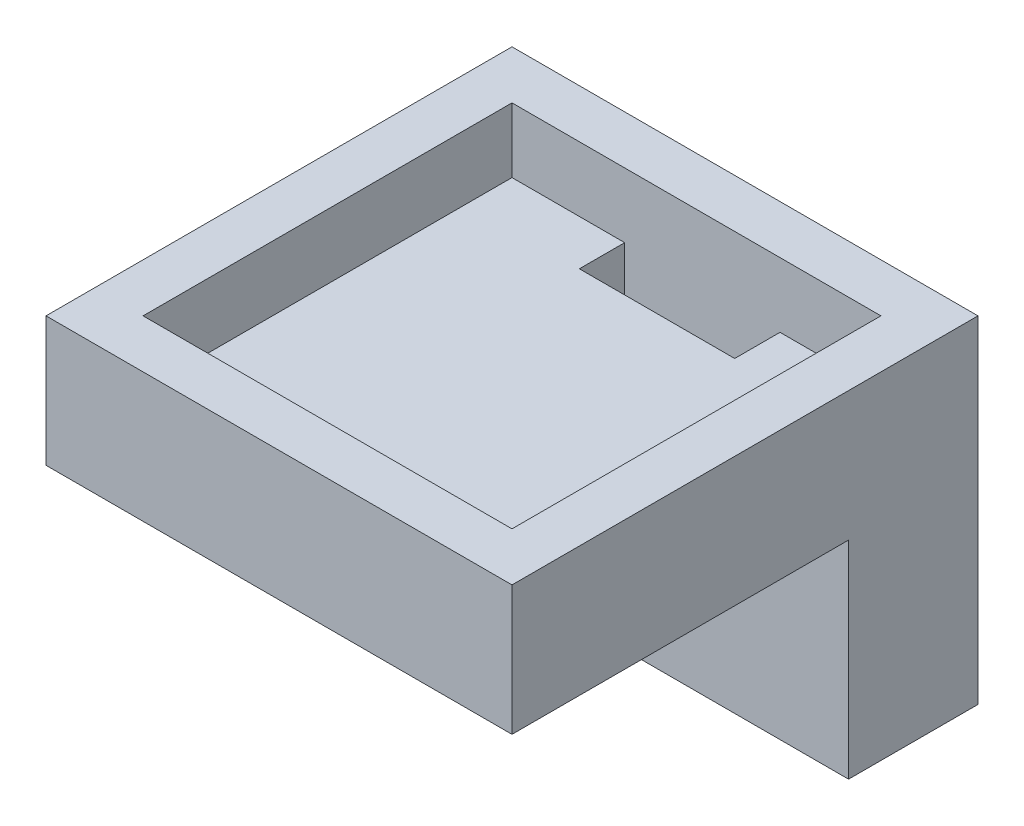
from build123d import *

# Parameters (mm, degrees)
SKETCH_1_W      = 36
SKETCH_1_H      = 36
SKETCH_1_W_2    = 12
SKETCH_1_H_2    = 3.5
EXTRUDE_1_DEPTH = 5
SKETCH_2_W      = 36
SKETCH_2_H      = 36
SKETCH_2_W_2    = 28.5
SKETCH_2_H_2    = 28.5
EXTRUDE_3_DEPTH = 10
SKETCH_3_W      = 36
SKETCH_3_H      = 10
SKETCH_3_W_2    = 12
SKETCH_3_H_2    = 3.5
EXTRUDE_4_DEPTH = 16


with BuildPart() as part:
    # 草圖1 → 填料-伸長1 (new body)
    with BuildSketch(Plane(origin=(0, 0, 0), x_dir=(1, 0, 0), z_dir=(0, 1, 0))):
        Rectangle(SKETCH_1_W, SKETCH_1_H)
        with Locations((0.454747486, 12.5)):
            Rectangle(SKETCH_1_W_2, SKETCH_1_H_2, mode=Mode.SUBTRACT)
    extrude(amount=EXTRUDE_1_DEPTH)

    # 草圖2 → 填料-伸長3 (add)
    with BuildSketch(Plane(origin=(0, 0, 0), x_dir=(1, 0, 0), z_dir=(0, 1, 0))):
        Rectangle(SKETCH_2_W, SKETCH_2_H)
        Rectangle(SKETCH_2_W_2, SKETCH_2_H_2, mode=Mode.SUBTRACT)
    extrude(amount=EXTRUDE_3_DEPTH)

    # 草圖3 → 填料-伸長4 (add)
    with BuildSketch(Plane(origin=(0, 0, 0), x_dir=(1, 0, 0), z_dir=(0, 1, 0))):
        with Locations((0, 13)):
            Rectangle(SKETCH_3_W, SKETCH_3_H)
        with Locations((0.454747486, 12.5)):
            Rectangle(SKETCH_3_W_2, SKETCH_3_H_2, mode=Mode.SUBTRACT)
    extrude(amount=-EXTRUDE_4_DEPTH)


solid = part.part
